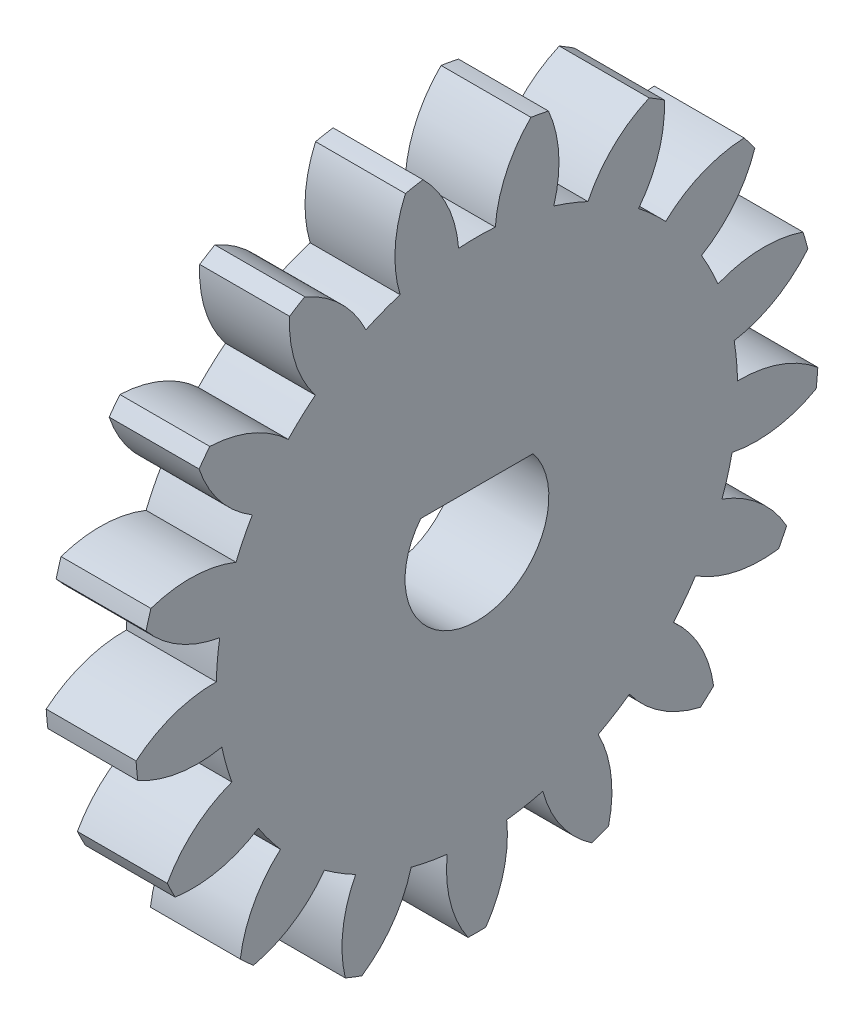
from build123d import *

# Parameters (mm, degrees)
BASPROSKE_W         = 5
BASPROSKE_H         = 19
TOOTHCUT_DEPTH      = 28.331300737
TEETHCUTS_COUNT     = 17
BORSKE_R            = 4
BORE_DEPTH          = 50.0000508
BOSS_EXTRUDE1_DEPTH = 5


with BuildPart() as part:
    # BasProSke → Base-Revolve (revolve)
    with BuildSketch(Plane(origin=(0, 0, 0), x_dir=(1, 0, 0), z_dir=(0, 1, 0)), mode=Mode.PRIVATE) as base_revolve_sk:
        with Locations((2.5, 9.5)):
            Rectangle(BASPROSKE_W, BASPROSKE_H)
    revolve(base_revolve_sk.sketch.rotate(Axis((-10, 0, 0), (1, 0, 0)), 180), axis=Axis((-10, 0, 0), (1, 0, 0)))

    # TooCutSke → ToothCut (cut, through all)
    with BuildSketch(Plane(origin=(0, 0, 0), x_dir=(0, 0, -1), z_dir=(1, 0, 0))):
        with BuildLine():
            ThreePointArc((1.020352389, 14.463052306), (0, 14.499), (-1.020352389, 14.463052306))
            ThreePointArc((-1.020352389, 14.463052306), (-1.632621885, 16.804485203), (-3.026143023, 18.783192049))
            ThreePointArc((-3.026143023, 18.783192049), (0, 19.0254), (3.026143023, 18.783192049))
            ThreePointArc((3.026143023, 18.783192049), (1.632621885, 16.804485203), (1.020352389, 14.463052306))
        make_face()
    toothcut = extrude(amount=TOOTHCUT_DEPTH, mode=Mode.SUBTRACT)

    # TeethCuts: ToothCut ×17 about axis
    teethcuts_axis = Axis((0, 0, 0), (1, 0, 0))
    for i in range(1, TEETHCUTS_COUNT):
        add(toothcut.rotate(teethcuts_axis, i * 360 / TEETHCUTS_COUNT), mode=Mode.SUBTRACT)

    # BorSke → Bore (cut, symmetric)
    with BuildSketch(Plane(origin=(0, 0, 0), x_dir=(0, 0, -1), z_dir=(1, 0, 0))):
        with Locations(Location((0, 0, 0), (0, 0, 180))):
            Circle(BORSKE_R)
    extrude(amount=BORE_DEPTH, both=True, mode=Mode.SUBTRACT)

    # Sketch1 → Boss-Extrude1 (add)
    with BuildSketch(Plane(origin=(5, 0, 0), x_dir=(0, 0, -1), z_dir=(1, 0, 0))):
        with BuildLine():
            ThreePointArc((3.122498999, 2.5), (0, 4), (-3.122498999, 2.5))
            Line((-3.122498999, 2.5), (3.122498999, 2.5))
        make_face()
    extrude(amount=-BOSS_EXTRUDE1_DEPTH)


solid = part.part
